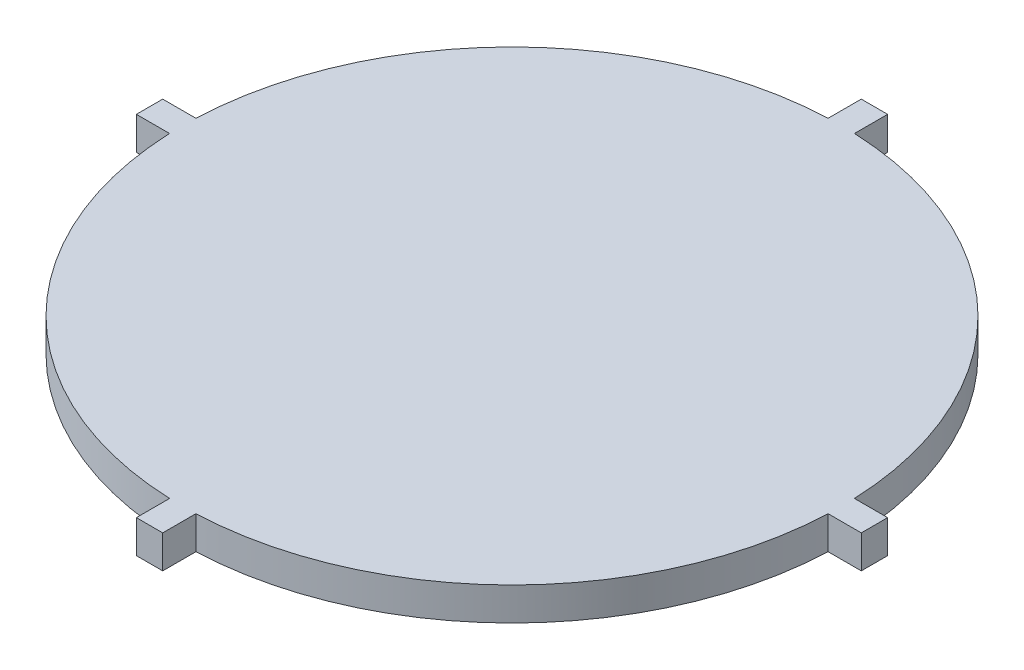
from build123d import *

# Parameters (mm, degrees)
EXTRUDE_2_DEPTH = 10


with BuildPart() as part:
    # 草图3 → 凸台-拉伸2 (new body)
    with BuildSketch(Plane(origin=(0, 0, 0), x_dir=(1, 0, 0), z_dir=(0, 1, 0))):
        with BuildLine():
            Line((0, 110), (-4, 110))
            Line((-4, 110), (-4, 99.919967974))
            ThreePointArc((-4, 99.919967974), (-70.710678119, 70.710678119), (-99.919967974, 4))
            Line((-99.919967974, 4), (-110, 4))
            Line((-110, 4), (-110, 0))
            Line((-110, 0), (-110, -4))
            Line((-110, -4), (-99.919967974, -4))
            ThreePointArc((-99.919967974, -4), (-70.710678119, -70.710678119), (-4, -99.919967974))
            Line((-4, -99.919967974), (-4, -110))
            Line((-4, -110), (0, -110))
            Line((0, -110), (4, -110))
            Line((4, -110), (4, -99.919967974))
            ThreePointArc((4, -99.919967974), (70.710678119, -70.710678119), (99.919967974, -4))
            Line((99.919967974, -4), (110, -4))
            Line((110, -4), (110, 0))
            Line((110, 0), (110, 4))
            Line((110, 4), (99.919967974, 4))
            ThreePointArc((99.919967974, 4), (70.710678119, 70.710678119), (4, 99.919967974))
            Line((4, 99.919967974), (4, 110))
            Line((4, 110), (0, 110))
        make_face()
    extrude(amount=EXTRUDE_2_DEPTH)


solid = part.part
